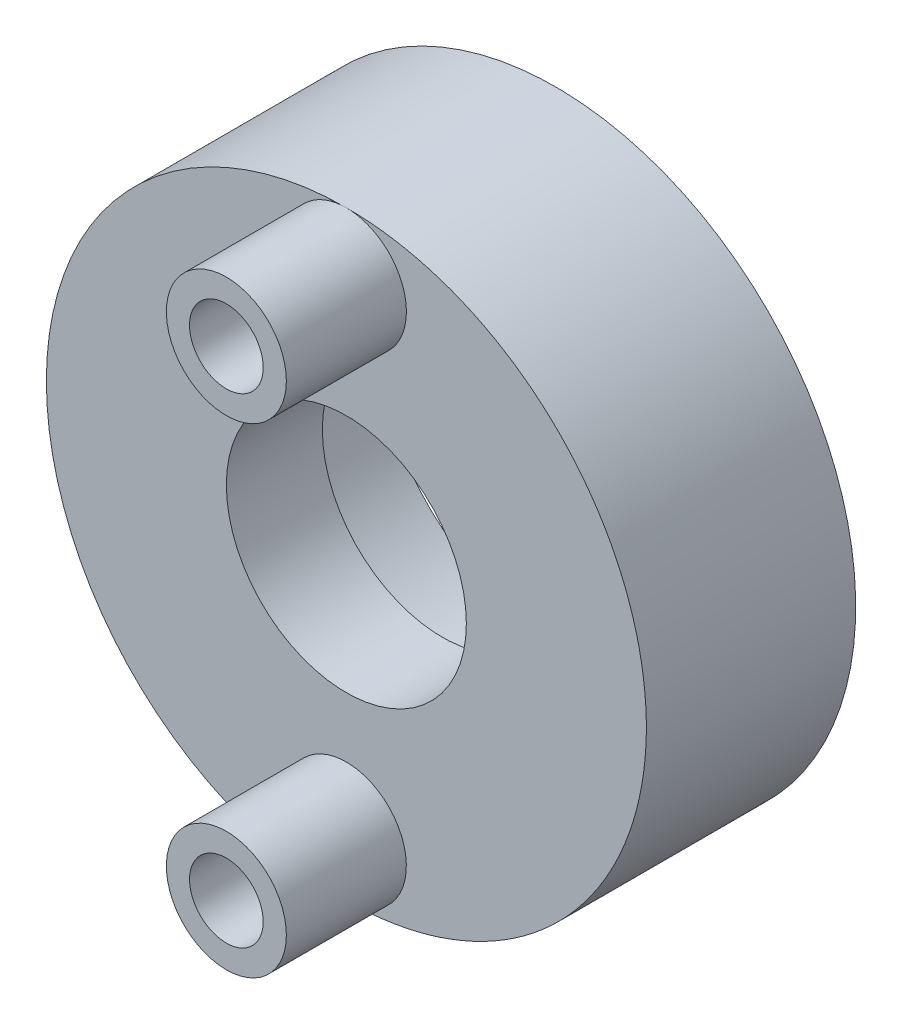
from build123d import *

# Parameters (mm, degrees)
SKETCH1_R           = 15.875
SKETCH1_R_2         = 1.95
SKETCH1_R_3         = 6.35
BOSS_EXTRUDE1_DEPTH = 5.08
BOSS_EXTRUDE2_START = 6.35
SKETCH1_3_R         = 3.175
SKETCH1_3_R_2       = 1.95
BOSS_EXTRUDE2_DEPTH = 6.35
SKETCH2_R           = 15.875
SKETCH2_R_2         = 9.5
BOSS_EXTRUDE3_DEPTH = 6


with BuildPart() as part:
    # Sketch1 → Boss-Extrude1 (new body)
    with BuildSketch(Plane.XY):
        Circle(SKETCH1_R)
        with Locations((0, 12.7)):
            Circle(SKETCH1_R_2, mode=Mode.SUBTRACT)
        Circle(SKETCH1_R_3, mode=Mode.SUBTRACT)
        with Locations((0, -12.7)):
            Circle(SKETCH1_R_2, mode=Mode.SUBTRACT)
    extrude(amount=-BOSS_EXTRUDE1_DEPTH)

    # Sketch1<3> → Boss-Extrude2 (add)
    # profile 1 of 2: a face of its own
    with BuildSketch(Plane.XY.offset(BOSS_EXTRUDE2_START)):
        with Locations((0, 12.7)):
            Circle(SKETCH1_3_R)
        with Locations((0, 12.7)):
            Circle(SKETCH1_3_R_2, mode=Mode.SUBTRACT)
    # profile 2 of 2: a face of its own
    with BuildSketch(Plane.XY.offset(BOSS_EXTRUDE2_START)):
        with Locations((0, -12.7)):
            Circle(SKETCH1_3_R)
        with Locations((0, -12.7)):
            Circle(SKETCH1_3_R_2, mode=Mode.SUBTRACT)
    extrude(amount=-BOSS_EXTRUDE2_DEPTH)

    # Sketch2 → Boss-Extrude3 (add)
    with BuildSketch(Plane(origin=(0, 0, -5.08), x_dir=(-1, 0, 0), z_dir=(0, 0, -1))):
        Circle(SKETCH2_R)
        Circle(SKETCH2_R_2, mode=Mode.SUBTRACT)
    extrude(amount=BOSS_EXTRUDE3_DEPTH)


solid = part.part
